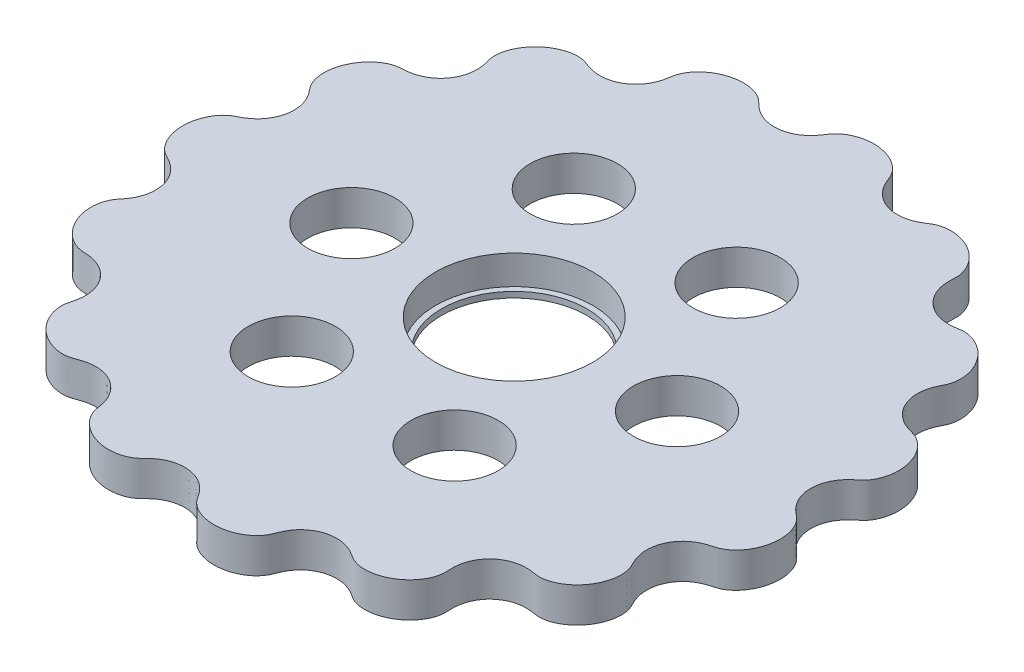
from build123d import *

# Parameters (mm, degrees)
SKETCH_3_R      = 13.5
SKETCH_3_R_2    = 7.5
EXTRUDE_1_DEPTH = 6
SKETCH_4_R      = 13.5
SKETCH_4_R_2    = 12.5
EXTRUDE_2_DEPTH = 1


with BuildPart() as part:
    # 草图3 → 凸台-拉伸1 (new body)
    with BuildSketch(Plane(origin=(0, 0, 0), x_dir=(1, 0, 0), z_dir=(0, 1, 0))):
        with BuildLine():
            add(Edge.make_bspline(
                [(51.01163563, -0.379051708), (51.012636965, -0.396006671), (51.016098263, -0.450990281), (51.025828979, -0.578552225), (51.046737153, -0.776690058), (51.093469337, -1.101517323), (51.181386474, -1.522332912), (51.320807889, -2.00418463), (51.528921086, -2.536312768), (51.79673185, -3.071914836), (52.128779964, -3.602440557), (52.501284936, -4.084469747), (52.904092752, -4.518236544), (53.309168695, -4.892372651), (53.701959058, -5.218311601), (54.113668186, -5.544585045), (54.499073102, -5.924245212), (54.840280597, -6.362369018), (55.137786403, -6.847536836), (55.426313596, -7.446050906), (55.678640263, -8.163236462), (55.874351539, -9.044501633), (55.960651562, -10.085416056), (55.901975522, -11.172747607), (55.683714845, -12.284286845), (55.327542995, -13.313412802), (54.85598465, -14.245797701), (54.343894545, -14.990398865), (53.841584547, -15.563366179), (53.353400219, -16.012322124), (52.902869601, -16.353894758), (52.461127976, -16.620197904), (52.038456269, -16.816496176), (51.646303522, -16.951374242), (51.295628125, -17.047049197), (50.916758452, -17.148991375), (50.513224324, -17.271023745), (50.089197315, -17.42380395), (49.649390737, -17.615846031), (49.083281062, -17.912090593), (48.403544483, -18.364557301), (47.67177397, -19.02340794), (46.970397468, -19.937580934), (46.435988791, -20.994103306), (46.111721831, -22.126924282), (46.012426238, -23.242197017), (46.103570603, -24.295734057), (46.307811825, -25.132670902), (46.543516138, -25.777342662), (46.758061404, -26.248100024), (46.913965909, -26.560287003), (47.07179216, -26.871404832), (47.236210683, -27.211266012), (47.39813187, -27.647399778), (47.524348468, -28.186614004), (47.59238117, -28.766262296), (47.602567277, -29.438415211), (47.530063921, -30.196257575), (47.338051303, -31.083041789), (46.978662231, -32.072588582), (46.310946214, -33.334824003), (45.404191589, -34.450933622), (44.346954088, -35.342894835), (43.266412723, -35.943185086), (42.543707847, -36.236044449), (41.861243978, -36.423723693), (41.314214673, -36.509594853), (40.830791461, -36.530993617), (40.361394619, -36.503072757), (39.922266728, -36.437322215), (39.42899914, -36.356804223), (38.874711139, -36.299769905), (38.306495736, -36.281889419), (37.727141986, -36.312383036), (36.990025594, -36.417315193), (36.094216893, -36.662521458), (35.125063449, -37.108970321), (34.15663344, -37.810425037), (33.346810544, -38.673297603), (32.733185023, -39.630537353), (32.364952727, -40.52646323), (32.168269198, -41.306633787), (32.077794259, -41.928980196), (32.041798257, -42.399410779), (32.035817088, -42.843233461), (32.049658153, -43.258944219), (32.071435175, -43.646314699), (32.082561066, -44.006643074), (32.06318868, -44.41703934), (31.995322326, -44.873193616), (31.834169944, -45.501384219), (31.533442045, -46.239017593), (31.086331717, -47.012519559), (30.278358544, -48.042646891), (29.276699594, -48.93077967), (28.076523632, -49.658981844), (26.788780445, -50.135669767), (25.785728338, -50.35546997), (24.91416786, -50.429699063), (24.191666683, -50.410616841), (23.535477544, -50.321611376), (22.951146433, -50.177833782), (22.465082167, -49.994139337), (22.078221094, -49.792698061), (21.77950135, -49.607105717), (21.55460259, -49.461469206), (21.272460156, -49.28089372), (20.927970601, -49.073822986), (20.501280274, -48.847371885), (19.98459796, -48.622310998), (19.4340272, -48.43645622), (18.851889458, -48.297807284), (18.106895584, -48.193165332), (17.187424061, -48.182376514), (16.13969927, -48.342952735), (15.030501563, -48.742888637), (14.035991988, -49.329692276), (13.240731017, -50.015326524), (12.616682474, -50.75626955), (12.185697983, -51.44570614), (11.899083887, -52.028074198), (11.687786356, -52.54170402), (11.525969901, -52.974365019), (11.33593123, -53.420222678), (11.081221246, -53.858759153), (10.767284656, -54.282298487), (10.396827941, -54.685719902), (9.919011296, -55.117974231), (9.319245997, -55.554806624), (8.553298771, -55.987290526), (7.609839589, -56.366464509), (6.572809168, -56.631448613), (5.456156575, -56.757847521), (4.370637986, -56.728653541), (3.337232456, -56.558171102), (2.473478469, -56.293168133), (1.778505072, -55.987392764), (1.200285726, -55.653889697), (0.73146691, -55.318324107), (0.329713816, -54.957889619), (-0.003097916, -54.580809586), (-0.269087063, -54.19863636), (-0.499601016, -53.837535516), (-0.799029856, -53.397429441), (-1.189012122, -52.894475572), (-1.751769921, -52.301799529), (-2.548688398, -51.673072513), (-3.512717298, -51.147106178), (-4.634066522, -50.786366926), (-5.81969693, -50.641957065), (-6.988462149, -50.722567719), (-8.038503193, -50.997084371), (-8.949443555, -51.406614908), (-9.640710068, -51.844084328), (-10.158814719, -52.253500395), (-10.584145872, -52.644700339), (-10.889072283, -52.952705161), (-11.154868079, -53.212921229), (-11.451215884, -53.467600557), (-11.78354468, -53.707933175), (-12.208459303, -53.952917436), (-12.730541039, -54.182319536), (-13.363688348, -54.389891412), (-14.110403189, -54.547393513), (-15.012501816, -54.628540846), (-16.059210957, -54.581142165), (-17.130900646, -54.384738661), (-18.204000191, -54.028134424), (-19.151641201, -53.558608161), (-19.968714753, -53.010830606), (-20.712149458, -52.365120528), (-21.270708881, -51.731504828), (-21.701097374, -51.087995674), (-21.991167193, -50.489109658), (-22.154986609, -50.030611741), (-22.258466063, -49.592621258), (-22.322668692, -49.18465521), (-22.389863621, -48.771257161), (-22.473889418, -48.354633684), (-22.608544015, -47.83127467), (-22.842409604, -47.154586972), (-23.231773817, -46.357530986), (-23.854441237, -45.479093733), (-24.687100314, -44.66773694), (-25.669182528, -44.018807742), (-26.638896614, -43.61781519), (-27.515397678, -43.410633222), (-28.252353758, -43.332291871), (-28.847185291, -43.325423178), (-29.432181089, -43.372473584), (-30.002961348, -43.469302463), (-30.561393956, -43.612573785), (-31.037267018, -43.772757996), (-31.438664101, -43.927066301), (-31.842738166, -44.079190923), (-32.257938833, -44.206065066), (-32.761110976, -44.296302577), (-33.347026176, -44.329685098), (-34.022485716, -44.295710359), (-34.778209494, -44.169575251), (-35.653495774, -43.911568332), (-36.617874571, -43.475712072), (-37.770375602, -42.745840068), (-38.793268933, -41.792590685), (-39.611012082, -40.694850409), (-40.139469014, -39.611558739), (-40.397619501, -38.854637347), (-40.542590963, -38.200830595), (-40.611240159, -37.664274444), (-40.624389568, -37.163421513), (-40.588819189, -36.703768181), (-40.513006952, -36.289581673), (-40.41686449, -35.920940489), (-40.286582508, -35.435567394), (-40.174151845, -34.931715987), (-40.097743064, -34.407186115), (-40.054971838, -33.709774995), (-40.082273673, -32.943353765), (-40.242037331, -32.026560859), (-40.616126354, -30.990542195), (-41.197611384, -29.986165545), (-41.971848863, -29.089030143), (-42.812961852, -28.431173325), (-43.637402382, -27.983641915), (-44.339646438, -27.711484447), (-44.90355129, -27.549890843), (-45.467579924, -27.439227801), (-46.026746746, -27.372574042), (-46.531025338, -27.344081888), (-46.978608162, -27.321723031), (-47.449106582, -27.260783762), (-47.923998373, -27.147218015), (-48.449120043, -26.955702308), (-49.087742214, -26.635113973), (-49.744552721, -26.200769264), (-50.69248899, -25.388689128), (-51.567380372, -24.275683023), (-52.246845073, -22.949352525), (-52.678699027, -21.387613173), (-52.793769017, -20.238139077), (-52.741492939, -19.25127531), (-52.586894171, -18.447713077), (-52.419445072, -17.882932092), (-52.203117922, -17.369622459), (-51.944518987, -16.91216856), (-51.648893248, -16.515613832), (-51.353427052, -16.158195315), (-51.000143399, -15.700370156), (-50.615454328, -15.12360787), (-50.214967714, -14.348643846), (-49.8746563, -13.332682212), (-49.710379058, -12.217455026), (-49.762574026, -11.03808385), (-50.036507859, -9.886275465), (-50.503510542, -8.837958509), (-51.10161273, -7.968015935), (-51.766978185, -7.273067631), (-52.374574476, -6.789173406), (-52.887289494, -6.455447762), (-53.352037371, -6.196117293), (-53.755760761, -5.991387675), (-54.181108058, -5.77007629), (-54.601894288, -5.487313446), (-55.006072727, -5.138643541), (-55.388048188, -4.728130362), (-55.802922817, -4.183974292), (-56.216251338, -3.488330326), (-56.593410265, -2.616000706), (-56.879370271, -1.563573565), (-57.019157424, -0.46439023), (-57.005590987, 0.66093031), (-56.843131963, 1.728912721), (-56.551170545, 2.721522094), (-56.186394114, 3.537826309), (-55.800505334, 4.184414307), (-55.403759149, 4.709517067), (-55.021310281, 5.12405885), (-54.606687933, 5.484860998), (-54.162334645, 5.783187527), (-53.699920149, 6.018964962), (-53.252216773, 6.24820427), (-52.780057248, 6.52128474), (-52.294263903, 6.851141852), (-51.71589326, 7.324690024), (-51.095841286, 7.979187641), (-50.509306659, 8.828560428), (-50.030900442, 9.89720993), (-49.759840114, 11.04410769), (-49.711893405, 12.240217724), (-49.876162068, 13.318114622), (-50.178181012, 14.242223125), (-50.52971148, 14.961728129), (-50.858319475, 15.494646562), (-51.150339615, 15.897114998), (-51.379136499, 16.186409835), (-51.610679136, 16.473316137), (-51.852852404, 16.782075364), (-52.10974698, 17.18569867), (-52.34870637, 17.695740829), (-52.53562586, 18.251125294), (-52.679262415, 18.884687779), (-52.76298883, 19.593257363), (-52.770127739, 20.454037701), (-52.649521336, 21.45507159), (-52.37710072, 22.498135141), (-51.932414798, 23.555214196), (-51.372916031, 24.492393413), (-50.728058184, 25.303083691), (-49.981899685, 26.021062368), (-49.253581903, 26.545651597), (-48.545943564, 26.919382078), (-47.933614594, 27.141662598), (-47.484345307, 27.253170132), (-47.076262596, 27.311337093), (-46.715577337, 27.335581909), (-46.326662287, 27.35491162), (-45.910093538, 27.386464401), (-45.467486917, 27.441746767), (-45.001489504, 27.530493826), (-44.390122037, 27.691166677), (-43.63353164, 27.976346331), (-42.780817592, 28.447040578), (-41.896716735, 29.170159204), (-41.136621939, 30.071230655), (-40.559215307, 31.099273929), (-40.22086106, 32.118250403), (-40.072759794, 33.067745443), (-40.056295652, 33.857603252), (-40.106654125, 34.496349042), (-40.20749924, 35.096196471), (-40.341838555, 35.656328375), (-40.48019657, 36.141660348), (-40.567752371, 36.567426003), (-40.613757337, 37.001234025), (-40.62282051, 37.442011134), (-40.582252751, 37.956976113), (-40.459426217, 38.624846617), (-40.235654434, 39.360872364), (-39.866512911, 40.199557043), (-39.309320775, 41.104994788), (-38.594456754, 41.968784409), (-37.719295373, 42.75838965), (-36.789095946, 43.379820211), (-35.836387055, 43.83998263), (-34.969104946, 44.121603898), (-34.218363306, 44.269969525), (-33.544990651, 44.326385846), (-32.95843361, 44.314846856), (-32.406806938, 44.240573847), (-31.898786557, 44.103901319), (-31.435973671, 43.924749946), (-30.998742321, 43.759400955), (-30.449031249, 43.578934681), (-29.778462552, 43.416416057), (-28.919136494, 43.307853129), (-27.856885334, 43.338339827), (-26.757020323, 43.566720828), (-25.669242027, 44.020665658), (-24.683977881, 44.67263336), (-23.860329877, 45.471141806), (-23.292388076, 46.268980746), (-22.921613592, 46.992071671), (-22.692081695, 47.584780296), (-22.551115923, 48.040744903), (-22.446748253, 48.476840672), (-22.369772266, 48.889348103), (-22.30907285, 49.275333177), (-22.24908799, 49.632619625), (-22.152299374, 50.034436946), (-21.997800199, 50.47240036), (-21.7764477, 50.936120456), (-21.481999104, 51.416053965), (-21.085390589, 51.944094372), (-20.567892283, 52.498768074), (-19.881775746, 53.080833623), (-19.005925355, 53.642317721), (-18.014544089, 54.10382881), (-16.917755416, 54.437693499), (-15.854883494, 54.601631177), (-14.851571042, 54.619920694), (-13.999888156, 54.526575717), (-13.30635686, 54.373209181), (-12.692772347, 54.168441339), (-12.160432636, 53.929038788), (-11.67777406, 53.64301234), (-11.301499319, 53.350314171), (-11.01869913, 53.080193718), (-10.758464297, 52.820763703), (-10.496389098, 52.563021195), (-10.130364733, 52.230241188), (-9.640405437, 51.846722792), (-8.96917256, 51.419058765), (-8.091302066, 51.016511644), (-7.044921733, 50.730852856), (-5.854702922, 50.640019689), (-4.684166889, 50.775730167), (-3.563729152, 51.128067311), (-2.648584451, 51.615210548), (-1.92452174, 52.158925432), (-1.386428638, 52.682094745), (-1.002459079, 53.129330143), (-0.677134277, 53.57088014), (-0.398166752, 53.994099349), (-0.116226677, 54.43377688), (0.224141444, 54.850632425), (0.625310095, 55.230476846), (1.077158674, 55.572223454), (1.641562689, 55.916774892), (2.326729314, 56.23778879), (3.179708152, 56.519848314), (4.201634107, 56.710425783), (5.286607515, 56.76309415), (6.4143555, 56.659951017), (7.476553752, 56.410474069), (8.45619617, 56.034556252), (9.252089462, 55.598359502), (9.875157204, 55.154011424), (10.372440912, 54.710915363), (10.758158399, 54.294423103), (11.048766121, 53.903912985), (11.256903693, 53.556027888), (11.425842741, 53.212115708), (11.562504943, 52.87734577), (11.710329672, 52.482825234), (11.920937339, 51.981253995), (12.192839142, 51.438943529), (12.598530775, 50.787802025), (13.198760459, 50.057172755), (13.987550782, 49.360558952), (14.980729535, 48.766557922), (16.097631146, 48.356243016), (17.268191334, 48.165445507), (18.328354558, 48.196739565), (19.243968746, 48.374647189), (19.960541672, 48.611325295), (20.5093612, 48.850340866), (21.014626702, 49.120783269), (21.421669898, 49.373573129), (21.764437644, 49.599358256), (22.060969804, 49.779948767), (22.311466706, 49.913076849), (22.641881497, 50.06103344), (23.059114922, 50.205506364), (23.560978266, 50.325809567), (24.238944354, 50.415652533), (25.017821112, 50.429572063), (25.93918331, 50.333766445), (26.980892149, 50.076501367), (28.320021433, 49.537963934), (29.530806729, 48.745947259), (30.53118773, 47.779606682), (31.240467106, 46.759819217), (31.605568987, 46.066386361), (31.860617525, 45.40249422), (31.999705246, 44.863833596), (32.067283829, 44.382565523), (32.083646893, 43.9106438), (32.061370831, 43.465147412), (32.034825975, 42.963387147), (32.039298209, 42.403135116), (32.085631028, 41.833287915), (32.181954655, 41.257822655), (32.37129979, 40.533249792), (32.719541554, 39.667157229), (33.273889792, 38.758464567), (34.07449052, 37.885621227), (35.006729617, 37.189947443), (35.99710638, 36.696841031), (36.894670818, 36.431990247), (37.657163921, 36.317456435), (38.359249838, 36.281360103), (38.892386858, 36.299048394), (39.408271061, 36.355690537), (39.90685682, 36.433757037), (40.283896282, 36.49248681), (40.704479724, 36.528943425), (41.167053268, 36.520427751), (41.666232365, 36.458578469), (42.195748712, 36.337034254), (42.834691931, 36.127101373), (43.565118604, 35.793068276), (44.363343072, 35.298277129), (45.187952761, 34.610337541), (46.127887799, 33.581530303), (46.849364933, 32.419201824), (47.33698983, 31.180378429), (47.558922434, 30.000091266), (47.608782018, 29.239191464), (47.576155506, 28.56684479), (47.486324529, 27.989687469), (47.349021611, 27.499613345), (47.184272989, 27.099711864), (46.993135372, 26.714236164), (46.797441661, 26.333006931), (46.58673859, 25.879171444), (46.383134263, 25.342418763), (46.223744751, 24.788844095), (46.111612248, 24.216063473), (46.051248205, 23.627846644), (46.04494361, 22.89151376), (46.149324378, 22.001386242), (46.436295931, 20.987860296), (46.974452085, 19.925053566), (47.70408644, 18.986501566), (48.49979204, 18.284766683), (49.285040786, 17.786751921), (49.968628081, 17.467408925), (50.513222505, 17.269216066), (51.008504106, 17.12208756), (51.447811398, 17.008518763), (51.911951658, 16.869184777), (52.384176305, 16.662271906), (52.855402395, 16.386448073), (53.318218224, 16.042213433), (53.795464221, 15.609026643), (54.270852173, 15.07782721), (54.77028349, 14.380822009), (55.246086989, 13.498665779), (55.627869722, 12.48715849), (55.878634786, 11.355234441), (55.96186779, 10.249659224), (55.895503135, 9.194203403), (55.71535988, 8.299342357), (55.47580588, 7.570015485), (55.196085007, 6.95669456), (54.903205812, 6.4545813), (54.579683508, 6.020244458), (54.234080704, 5.65658247), (53.881253649, 5.359209606), (53.552262969, 5.095629941), (53.228689342, 4.819234394), (52.91606422, 4.524948794), (52.543416158, 4.131137305), (52.180790619, 3.676554228), (51.84449683, 3.160547461), (51.579005858, 2.639763187), (51.409053977, 2.232035388), (51.299131013, 1.911474035), (51.23869696, 1.70972719), (51.203848572, 1.57939949), (51.189205979, 1.521216834), (51.184304697, 1.501346612), (51.170988304, 1.447360787), (51.158355613, 1.393206317), (51.134299517, 1.284593185), (51.112345738, 1.175437871), (51.091632656, 1.066045905), (51.073780042, 0.956249513), (51.06554033, 0.901255476), (51.057958691, 0.846170865), (51.038665913, 0.705998654), (51.023639594, 0.56528868), (51.012897573, 0.424186958), (51.006448786, 0.282840316), (51.003934816, 0.227738273), (51.002073863, 0.172606436), (50.999714401, 0.062282843), (51.000192633, -0.048161254), (51.00192227, -0.158597899), (51.00581983, -0.268884232), (51.008383665, -0.32398829), (51.01163563, -0.379051708)],
                knots=[0, 0, 0, 0, 0, 0.000162571, 0.000531499, 0.001269353, 0.002007207, 0.003407649, 0.00480809, 0.006244148, 0.007680205, 0.009349808, 0.011019412, 0.012287886, 0.013556361, 0.014824835, 0.01609331, 0.01750555, 0.01891779, 0.020328885, 0.02173998, 0.024098552, 0.026457124, 0.029272805, 0.032088485, 0.034883531, 0.037678576, 0.040059834, 0.042441093, 0.043838011, 0.045234929, 0.046642787, 0.048050645, 0.04895364, 0.049856636, 0.050759631, 0.051662627, 0.052853794, 0.054044961, 0.055236128, 0.056427295, 0.059198317, 0.062139229, 0.064968011, 0.067812677, 0.070899321, 0.073778183, 0.07602768, 0.078277177, 0.079433149, 0.08058912, 0.081167106, 0.081745092, 0.082901063, 0.084339583, 0.085778104, 0.087234625, 0.088691146, 0.091009739, 0.093328332, 0.096225252, 0.099122172, 0.105149209, 0.107502217, 0.109855226, 0.11136823, 0.112881235, 0.11452388, 0.115345202, 0.116166524, 0.117549375, 0.118932226, 0.120315076, 0.121697927, 0.123194182, 0.124690437, 0.127704897, 0.130895719, 0.133728951, 0.136499016, 0.139401721, 0.142133112, 0.143304308, 0.144475503, 0.145646699, 0.146817894, 0.147713139, 0.148608385, 0.14950363, 0.150398875, 0.151791055, 0.153183234, 0.155936098, 0.158287227, 0.160638357, 0.166155988, 0.169145103, 0.172134218, 0.174231979, 0.17632974, 0.177816799, 0.179303857, 0.180801413, 0.182298969, 0.182964741, 0.183630513, 0.184296285, 0.184962058, 0.186293602, 0.187625146, 0.18909136, 0.190557575, 0.192060932, 0.19356429, 0.196556931, 0.199663605, 0.202527345, 0.205209342, 0.207972493, 0.21004592, 0.212119346, 0.213267466, 0.214415586, 0.215563706, 0.216711826, 0.218076861, 0.219441896, 0.22079383, 0.222145765, 0.22447291, 0.226800056, 0.229510759, 0.232221462, 0.235077161, 0.23793286, 0.240265689, 0.242598519, 0.244030531, 0.245462543, 0.246890313, 0.248318084, 0.249382924, 0.250447765, 0.251512605, 0.252577446, 0.254671639, 0.256765833, 0.259612814, 0.262626645, 0.265521492, 0.268402195, 0.271413966, 0.274199968, 0.276245495, 0.278291022, 0.279522281, 0.28075354, 0.281984799, 0.282600429, 0.283216058, 0.284634927, 0.286053796, 0.287463818, 0.288873841, 0.291247715, 0.293621589, 0.296438337, 0.299255085, 0.302039329, 0.304823572, 0.306914036, 0.309004499, 0.311802451, 0.313190674, 0.314578897, 0.315604767, 0.316630637, 0.317656507, 0.318682377, 0.319767692, 0.320853008, 0.323023639, 0.325786465, 0.328549951, 0.331498544, 0.334513094, 0.337412293, 0.338915607, 0.340418922, 0.341867485, 0.343316048, 0.344740821, 0.346165593, 0.347590365, 0.348302752, 0.349015138, 0.350456587, 0.351898037, 0.353367238, 0.354836438, 0.357165938, 0.359495437, 0.362408056, 0.365320676, 0.370673193, 0.373293317, 0.375913441, 0.377257247, 0.378601052, 0.379941109, 0.381281166, 0.382227506, 0.383173847, 0.384120187, 0.385066527, 0.387222783, 0.388300911, 0.389379038, 0.392006179, 0.394827509, 0.397503642, 0.400268915, 0.403481187, 0.406531012, 0.408044568, 0.409558124, 0.410955688, 0.412353251, 0.413750814, 0.415148378, 0.415976531, 0.416804684, 0.418460989, 0.419989293, 0.421517597, 0.423892885, 0.426268174, 0.432354327, 0.435464595, 0.438574863, 0.44230336, 0.443774166, 0.445244971, 0.446695877, 0.448146783, 0.449299319, 0.450451855, 0.451604392, 0.452756928, 0.455044671, 0.457332413, 0.460244482, 0.463359395, 0.46617744, 0.46899361, 0.471945554, 0.4746996, 0.47661098, 0.47852236, 0.47964742, 0.48077248, 0.48189754, 0.4830226, 0.484409623, 0.485796646, 0.487190968, 0.48858529, 0.491201047, 0.493816803, 0.496602454, 0.499388105, 0.502176901, 0.504965697, 0.50730273, 0.509639762, 0.511036334, 0.512432905, 0.513834212, 0.515235519, 0.516485973, 0.517736426, 0.51898688, 0.520237333, 0.52190165, 0.523565967, 0.52640344, 0.52916804, 0.532105043, 0.535137259, 0.538042571, 0.540992557, 0.542877442, 0.544762326, 0.545984067, 0.547205808, 0.547816678, 0.548427548, 0.549649289, 0.551103601, 0.552557913, 0.554010422, 0.555462932, 0.557549555, 0.559636177, 0.562544922, 0.565453667, 0.568224684, 0.570995701, 0.573357038, 0.575718375, 0.578485366, 0.579883342, 0.581281319, 0.582179157, 0.583076996, 0.583974835, 0.584872674, 0.586050196, 0.587227718, 0.588405239, 0.589582761, 0.592327265, 0.595243259, 0.598032876, 0.600870099, 0.603978718, 0.606889179, 0.608637319, 0.610385459, 0.611815807, 0.613246156, 0.614676505, 0.616106853, 0.616832209, 0.617557565, 0.619008277, 0.62048188, 0.621955483, 0.624295882, 0.62663628, 0.629561767, 0.632487253, 0.635398533, 0.638309813, 0.64063941, 0.642969008, 0.644433955, 0.645898902, 0.647344007, 0.648789113, 0.649950811, 0.651112509, 0.652274206, 0.653435904, 0.655697425, 0.657958946, 0.660853545, 0.663951387, 0.66679238, 0.669601384, 0.672529985, 0.675287554, 0.67647219, 0.677656825, 0.67884146, 0.680026096, 0.680925979, 0.681825863, 0.682725747, 0.683625631, 0.685028771, 0.68643191, 0.687822168, 0.689212425, 0.691583707, 0.693954988, 0.696737963, 0.699520937, 0.702416038, 0.705311138, 0.707387778, 0.709464418, 0.710911021, 0.712357623, 0.713806423, 0.715255223, 0.716472865, 0.717081687, 0.717690508, 0.718908151, 0.720125794, 0.721995669, 0.723865544, 0.726801587, 0.729687578, 0.732712914, 0.735657196, 0.738439628, 0.741294522, 0.742960283, 0.744626044, 0.745886002, 0.747145959, 0.748405917, 0.749665875, 0.751072386, 0.752478897, 0.753882797, 0.755286698, 0.757634463, 0.759982228, 0.762784366, 0.765586505, 0.768393546, 0.771200588, 0.773591705, 0.775982822, 0.777386187, 0.778789551, 0.780202298, 0.781615045, 0.782213409, 0.782811774, 0.784008502, 0.78520523, 0.786401959, 0.788216042, 0.790030126, 0.792814822, 0.795767566, 0.798616186, 0.801464385, 0.804573619, 0.807481586, 0.809091913, 0.81070224, 0.812062255, 0.813422271, 0.814782286, 0.815462294, 0.816142302, 0.816871024, 0.817599746, 0.819057191, 0.820523565, 0.821989939, 0.824385643, 0.826781346, 0.829700606, 0.832619866, 0.838676643, 0.841040626, 0.843404608, 0.84492576, 0.846446912, 0.848095648, 0.848920016, 0.849744384, 0.851134821, 0.852525258, 0.853915695, 0.855306132, 0.856811256, 0.858316379, 0.861348477, 0.86455024, 0.867319547, 0.870013854, 0.872849109, 0.875487365, 0.876573349, 0.877659332, 0.879831298, 0.880779302, 0.881727305, 0.882675309, 0.883623312, 0.884969549, 0.886315786, 0.887664955, 0.889014123, 0.89164571, 0.894277296, 0.896965406, 0.899653516, 0.905451807, 0.907771215, 0.910090624, 0.91155211, 0.913013597, 0.914449241, 0.915884884, 0.916594817, 0.917304751, 0.918724617, 0.920144483, 0.921564349, 0.923003601, 0.924442853, 0.925937823, 0.927432792, 0.930311105, 0.933319708, 0.936343958, 0.939196667, 0.942055842, 0.943804974, 0.945554106, 0.946681958, 0.947809811, 0.948937663, 0.950065515, 0.951492174, 0.952918834, 0.954353088, 0.955787342, 0.957888878, 0.959990415, 0.962854835, 0.965719255, 0.968596301, 0.971473347, 0.97383486, 0.976196373, 0.977641088, 0.979085803, 0.980524353, 0.981962903, 0.983010731, 0.984058559, 0.985106387, 0.986154215, 0.987238615, 0.988323016, 0.990491817, 0.99192137, 0.993350923, 0.994119152, 0.994887381, 0.995271495, 0.995467321, 0.995467321, 0.995467321, 0.995467321, 0.995999366, 0.995999366, 0.99653141, 0.99653141, 0.997063454, 0.997063454, 0.997063454, 0.997063454, 0.998416628, 0.998416628, 0.998416628, 0.998416628, 0.998944419, 0.998944419, 0.999472209, 0.999472209, 1, 1, 1, 1, 1], degree=4, weights=[1, 1, 1, 1, 1, 1, 1, 1, 1, 1, 1, 1, 1, 1, 1, 1, 1, 1, 1, 1, 1, 1, 1, 1, 1, 1, 1, 1, 1, 1, 1, 1, 1, 1, 1, 1, 1, 1, 1, 1, 1, 1, 1, 1, 1, 1, 1, 1, 1, 1, 1, 1, 1, 1, 1, 1, 1, 1, 1, 1, 1, 1, 1, 1, 1, 1, 1, 1, 1, 1, 1, 1, 1, 1, 1, 1, 1, 1, 1, 1, 1, 1, 1, 1, 1, 1, 1, 1, 1, 1, 1, 1, 1, 1, 1, 1, 1, 1, 1, 1, 1, 1, 1, 1, 1, 1, 1, 1, 1, 1, 1, 1, 1, 1, 1, 1, 1, 1, 1, 1, 1, 1, 1, 1, 1, 1, 1, 1, 1, 1, 1, 1, 1, 1, 1, 1, 1, 1, 1, 1, 1, 1, 1, 1, 1, 1, 1, 1, 1, 1, 1, 1, 1, 1, 1, 1, 1, 1, 1, 1, 1, 1, 1, 1, 1, 1, 1, 1, 1, 1, 1, 1, 1, 1, 1, 1, 1, 1, 1, 1, 1, 1, 1, 1, 1, 1, 1, 1, 1, 1, 1, 1, 1, 1, 1, 1, 1, 1, 1, 1, 1, 1, 1, 1, 1, 1, 1, 1, 1, 1, 1, 1, 1, 1, 1, 1, 1, 1, 1, 1, 1, 1, 1, 1, 1, 1, 1, 1, 1, 1, 1, 1, 1, 1, 1, 1, 1, 1, 1, 1, 1, 1, 1, 1, 1, 1, 1, 1, 1, 1, 1, 1, 1, 1, 1, 1, 1, 1, 1, 1, 1, 1, 1, 1, 1, 1, 1, 1, 1, 1, 1, 1, 1, 1, 1, 1, 1, 1, 1, 1, 1, 1, 1, 1, 1, 1, 1, 1, 1, 1, 1, 1, 1, 1, 1, 1, 1, 1, 1, 1, 1, 1, 1, 1, 1, 1, 1, 1, 1, 1, 1, 1, 1, 1, 1, 1, 1, 1, 1, 1, 1, 1, 1, 1, 1, 1, 1, 1, 1, 1, 1, 1, 1, 1, 1, 1, 1, 1, 1, 1, 1, 1, 1, 1, 1, 1, 1, 1, 1, 1, 1, 1, 1, 1, 1, 1, 1, 1, 1, 1, 1, 1, 1, 1, 1, 1, 1, 1, 1, 1, 1, 1, 1, 1, 1, 1, 1, 1, 1, 1, 1, 1, 1, 1, 1, 1, 1, 1, 1, 1, 1, 1, 1, 1, 1, 1, 1, 1, 1, 1, 1, 1, 1, 1, 1, 1, 1, 1, 1, 1, 1, 1, 1, 1, 1, 1, 1, 1, 1, 1, 1, 1, 1, 1, 1, 1, 1, 1, 1, 1, 1, 1, 1, 1, 1, 1, 1, 1, 1, 1, 1, 1, 1, 1, 1, 1, 1, 1, 1, 1, 1, 1, 1, 1, 1, 1, 1, 1, 1, 1, 1, 1, 1, 1, 1, 1, 1, 1, 1, 1, 1, 1, 1, 1, 1, 1, 1, 1, 1, 1, 1, 1, 1, 1, 1, 1, 1, 1, 1, 1, 1, 1, 1, 1, 1, 1, 1, 1, 1, 1, 1, 1, 1, 1, 1, 1, 1, 1, 1, 1, 1, 1, 1, 1, 1, 1, 1, 1, 1, 1, 1, 1, 1, 1, 1, 1, 1, 1, 1, 1, 1, 1, 1, 1, 1, 1, 1, 1, 1, 1, 1, 1, 1, 1, 1, 1, 1, 1, 1, 1, 0.999480426, 0.999307234, 0.999480426, 1, 1, 1, 1, 1, 1, 1, 1, 1]))
        make_face()
        with Locations(Location((0, 0, 0), (0, 0, 270))):
            Circle(SKETCH_3_R, mode=Mode.SUBTRACT)
        with Locations(Location((-28, 0, 0), (0, 0, 270))):
            Circle(SKETCH_3_R_2, mode=Mode.SUBTRACT)
        with Locations(Location((-14, 24.248711306, 0), (0, 0, 270))):
            Circle(SKETCH_3_R_2, mode=Mode.SUBTRACT)
        with Locations(Location((14, 24.248711306, 0), (0, 0, 270))):
            Circle(SKETCH_3_R_2, mode=Mode.SUBTRACT)
        with Locations(Location((28, 0, 0), (0, 0, 270))):
            Circle(SKETCH_3_R_2, mode=Mode.SUBTRACT)
        with Locations(Location((14, -24.248711306, 0), (0, 0, 270))):
            Circle(SKETCH_3_R_2, mode=Mode.SUBTRACT)
        with Locations(Location((-14, -24.248711306, 0), (0, 0, 270))):
            Circle(SKETCH_3_R_2, mode=Mode.SUBTRACT)
    extrude(amount=EXTRUDE_1_DEPTH)

    # 草图4 → 凸台-拉伸2 (add)
    with BuildSketch(Plane.XZ):
        with Locations(Location((0, 0, 0), (0, 0, 270))):
            Circle(SKETCH_4_R)
        with Locations(Location((0, 0, 0), (0, 0, 270))):
            Circle(SKETCH_4_R_2, mode=Mode.SUBTRACT)
    extrude(amount=-EXTRUDE_2_DEPTH)


solid = part.part
